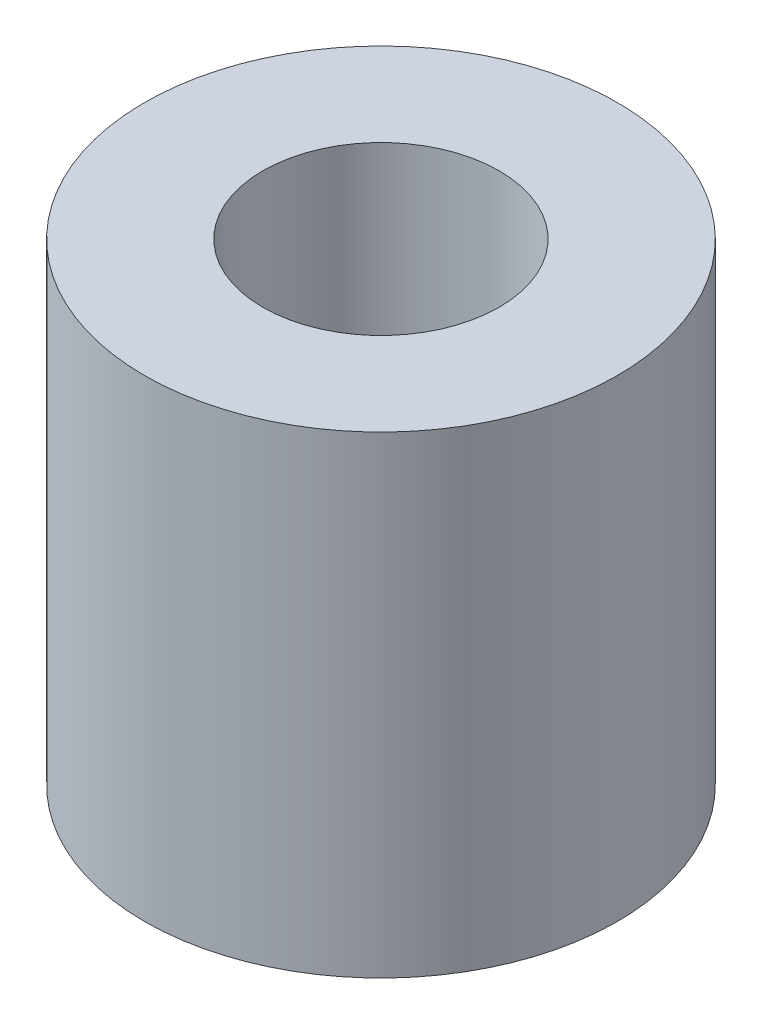
from build123d import *

# Parameters (mm, degrees)
SKETCH1_R           = 1
SKETCH1_R_2         = 0.5
BOSS_EXTRUDE1_DEPTH = 2


with BuildPart() as part:
    # Sketch1 → Boss-Extrude1 (new body)
    with BuildSketch(Plane(origin=(0, 0, 0), x_dir=(1, 0, 0), z_dir=(0, 1, 0))):
        with Locations(Location((0, 0, 0), (0, 0, 270))):
            Circle(SKETCH1_R)
        with Locations(Location((0, 0, 0), (0, 0, 270))):
            Circle(SKETCH1_R_2, mode=Mode.SUBTRACT)
    extrude(amount=BOSS_EXTRUDE1_DEPTH)


solid = part.part
